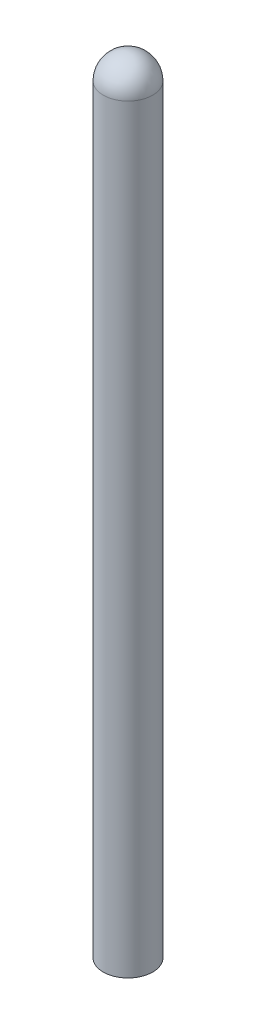
from build123d import *

# Parameters (mm, degrees)
SKETCH_1_R      = 0.75
EXTRUDE_1_DEPTH = 23


with BuildPart() as part:
    # 草图1 → 凸台-拉伸1 (new body)
    with BuildSketch(Plane(origin=(0, 0, 0), x_dir=(1, 0, 0), z_dir=(0, 1, 0))):
        with Locations(Location((0, 0, 0), (0, 0, 270))):
            Circle(SKETCH_1_R)
    extrude(amount=EXTRUDE_1_DEPTH)

    # 草图2 → 旋转1 (revolve)
    with BuildSketch(Plane(origin=(0, 0, 0), x_dir=(0, 0, -1), z_dir=(1, 0, 0))):
        with BuildLine():
            Line((0, 23.75), (0, 22.25))
            ThreePointArc((0, 22.25), (0.75, 23), (0, 23.75))
        make_face()
    revolve(axis=Axis((0, 23.75, 0), (0, -1, 0)))


solid = part.part
